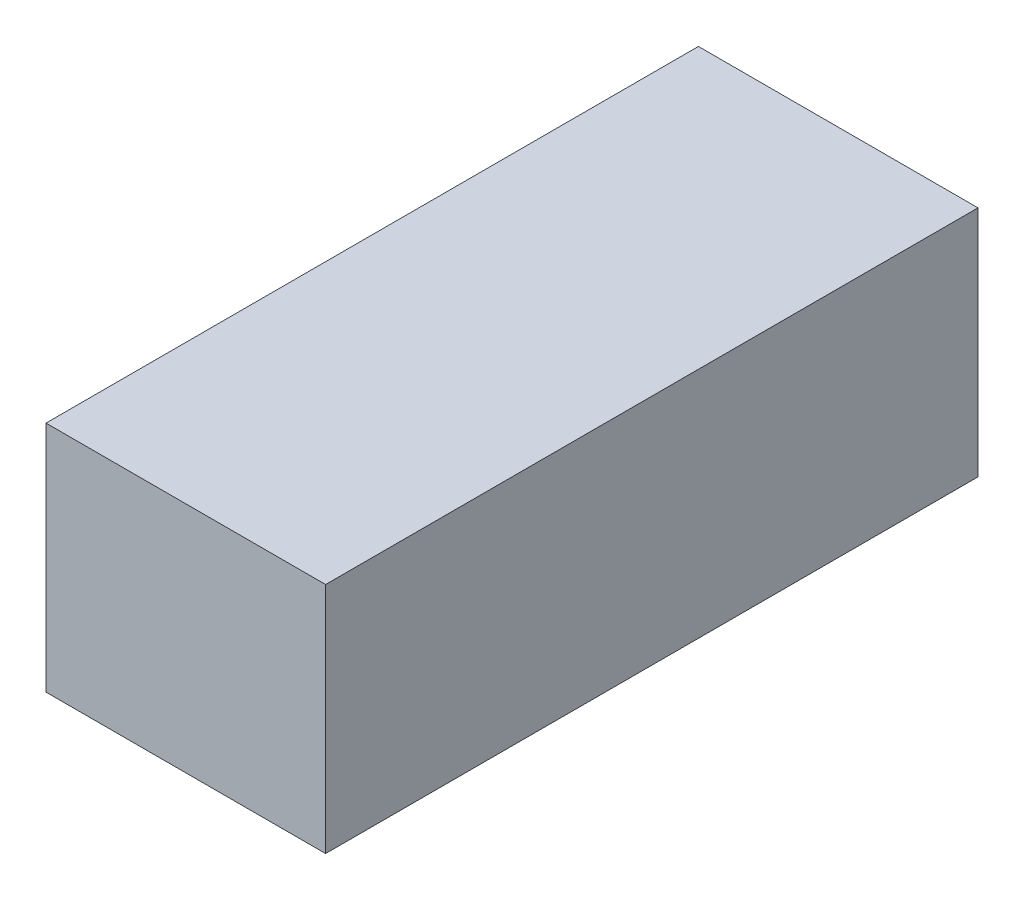
from build123d import *

# Parameters (mm, degrees)
SKETCH_1_W      = 18
SKETCH_1_H      = 15
EXTRUDE_1_DEPTH = 42


with BuildPart() as part:
    # 草图1 → 凸台-拉伸1 (new body)
    with BuildSketch(Plane.XY):
        with Locations((9, -7.5)):
            Rectangle(SKETCH_1_W, SKETCH_1_H)
    extrude(amount=EXTRUDE_1_DEPTH)


solid = part.part
